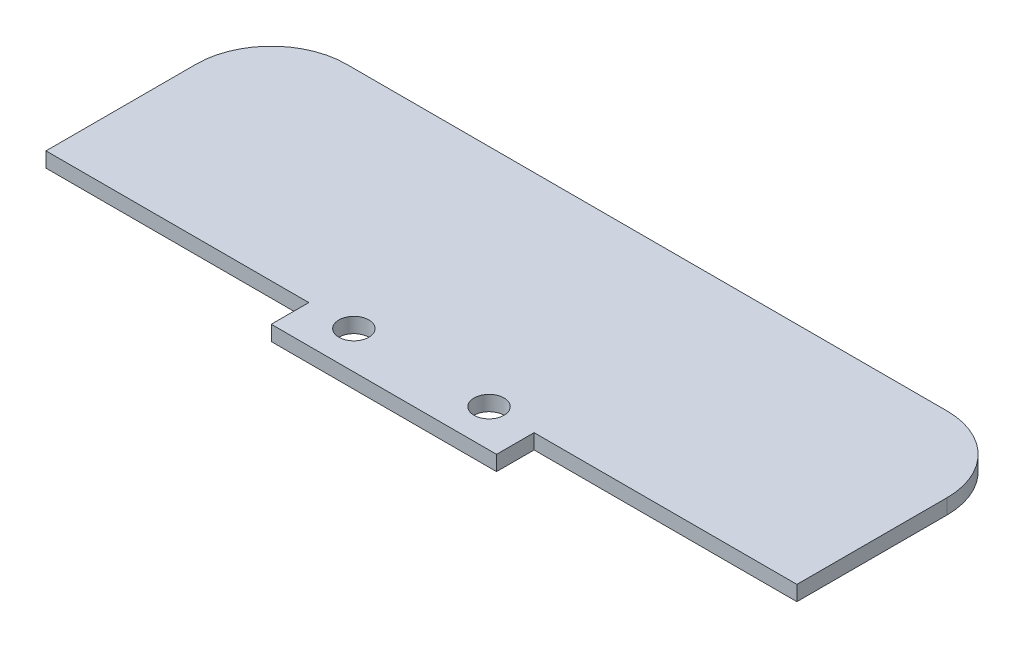
from build123d import *

# Parameters (mm, degrees)
SKETCH1_R           = 2
BOSS_EXTRUDE1_DEPTH = 2
FILLET1_R           = 10


with BuildPart() as part:
    # Sketch1 → Boss-Extrude1 (new body)
    with BuildSketch(Plane(origin=(0, 0, 0), x_dir=(1, 0, 0), z_dir=(0, 1, 0))):
        Polygon((50, 15), (50, -15), (15, -15), (15, -20), (-15, -20), (-15, -15), (-50, -15), (-50, 15), align=None)
        with Locations(Location((-9, -15, 0), (0, 0, 270))):
            Circle(SKETCH1_R, mode=Mode.SUBTRACT)
        with Locations(Location((9, -15, 0), (0, 0, 270))):
            Circle(SKETCH1_R, mode=Mode.SUBTRACT)
    extrude(amount=BOSS_EXTRUDE1_DEPTH)

    # Fillet1
    fillet1_edges = [part.edges().sort_by_distance(p)[0] for p in [
        (-50, 1, -15),
        (50, 1, -15),
    ]]
    fillet(fillet1_edges, radius=FILLET1_R)


solid = part.part
